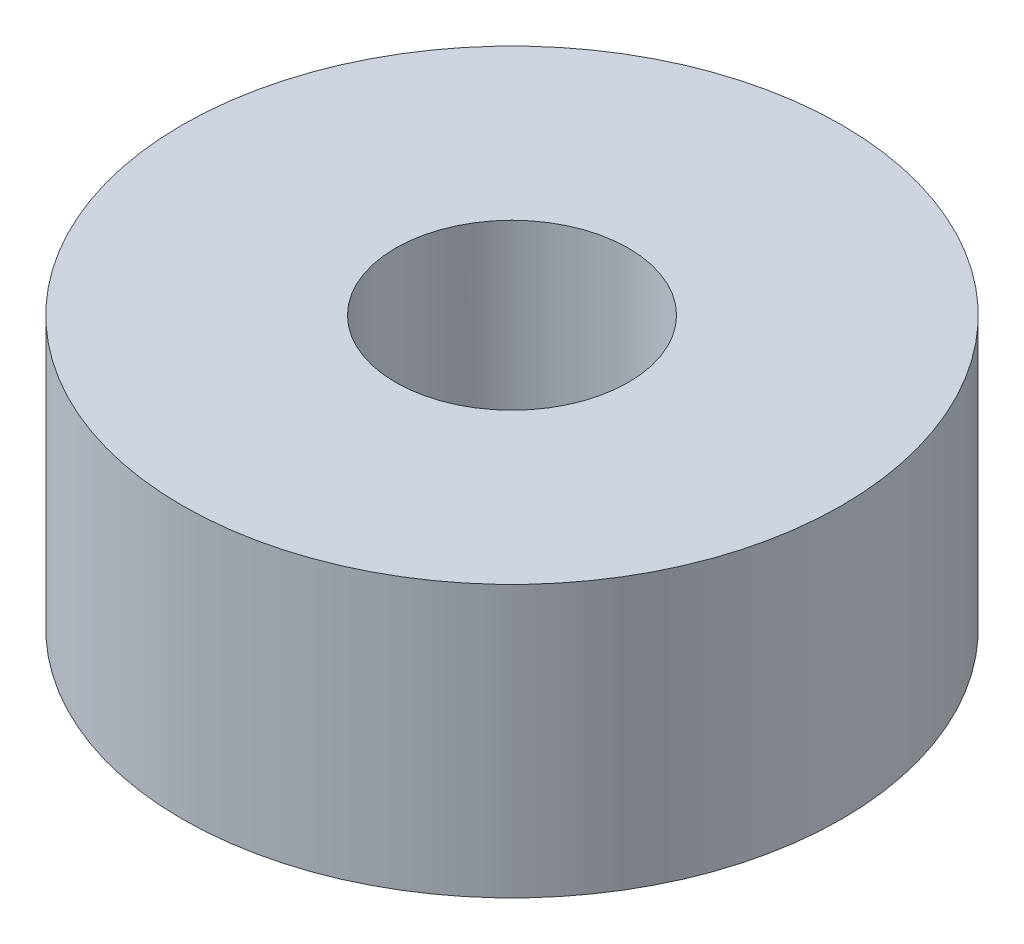
from build123d import *

# Parameters (mm, degrees)
SKETCH1_R           = 8.5
BOSS_EXTRUDE1_DEPTH = 7
SKETCH2_R           = 3
CUT_EXTRUDE1_DEPTH  = 10


with BuildPart() as part:
    # Sketch1 → Boss-Extrude1 (new body)
    with BuildSketch(Plane(origin=(0, 0, 0), x_dir=(1, 0, 0), z_dir=(0, 1, 0))):
        with Locations(Location((0, 0, 0), (0, 0, 270))):
            Circle(SKETCH1_R)
    extrude(amount=BOSS_EXTRUDE1_DEPTH)

    # Sketch2 → Cut-Extrude1 (cut)
    with BuildSketch(Plane.XZ):
        with Locations(Location((0, 0, 0), (0, 0, 270))):
            Circle(SKETCH2_R)
    extrude(amount=-CUT_EXTRUDE1_DEPTH, mode=Mode.SUBTRACT)


solid = part.part
